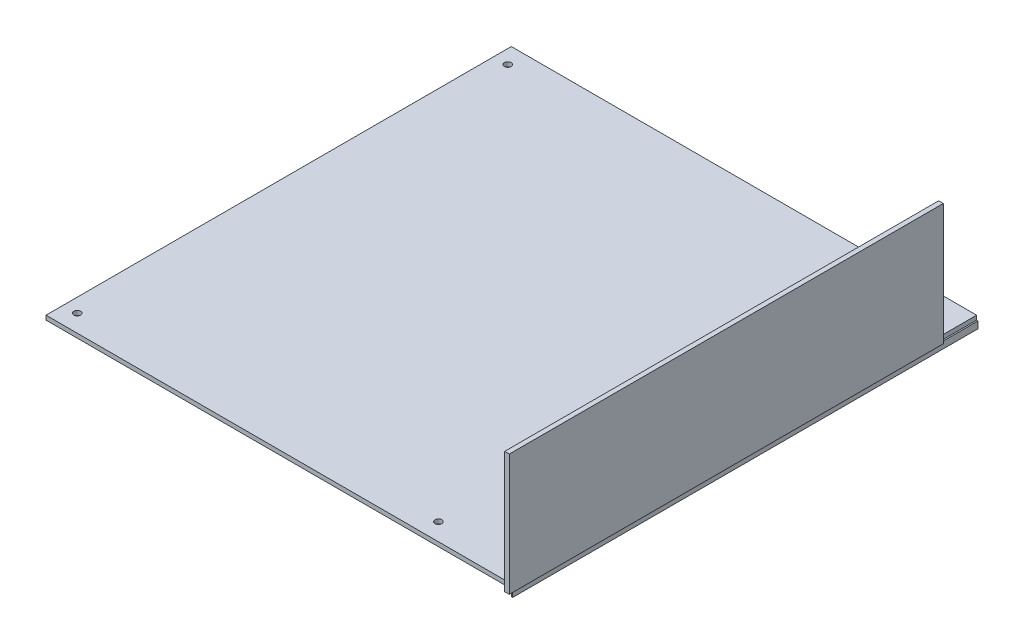
from build123d import *

# Parameters (mm, degrees)
SKETCH1_W              = 170.18
SKETCH1_H              = 170.18
PCB_DEPTH              = 1.57
M3X0_5_TAPPED_HOLE1_D  = 2.5
SKETCH5_W              = 158.75
SKETCH5_H              = 44.45
IO_SHIELD_DEPTH        = 1.7
SKETCH6_W              = 170.18
SKETCH6_H              = 2.5
IO_SHIELD_FLANGE_DEPTH = 0.5


with BuildPart() as part:
    # Sketch1 → pcb (new body)
    with BuildSketch(Plane(origin=(0, 0, 0), x_dir=(1, 0, 0), z_dir=(0, 1, 0))):
        with Locations((-85.09, 85.09)):
            Rectangle(SKETCH1_W, SKETCH1_H)
    extrude(amount=PCB_DEPTH)

    # M3x0.5 Tapped Hole1 (through all)
    with Locations(Plane(origin=(-165.1, 1.57, -163.83), x_dir=(0, 0, 1), z_dir=(0, 1, 0))):
        with Locations((0, 0), (0, 154.94), (157.48, 132.08), (157.48, 0)):
            Hole(M3X0_5_TAPPED_HOLE1_D / 2)

    # Sketch5 → io-shield (add)
    with BuildSketch(Plane(origin=(0, 0, 0), x_dir=(0, 0, -1), z_dir=(1, 0, 0))):
        with Locations((76.935, 22.525)):
            Rectangle(SKETCH5_W, SKETCH5_H)
    extrude(amount=IO_SHIELD_DEPTH)


with BuildPart() as body_2:
    # Sketch6 → io-shield-flange (new body)
    with BuildSketch(Plane(origin=(0, 0, 0), x_dir=(0, 0, -1), z_dir=(1, 0, 0))):
        with Locations((85.09, -1.25)):
            Rectangle(SKETCH6_W, SKETCH6_H)
    extrude(amount=IO_SHIELD_FLANGE_DEPTH)


solid = Compound([part.part, body_2.part])
